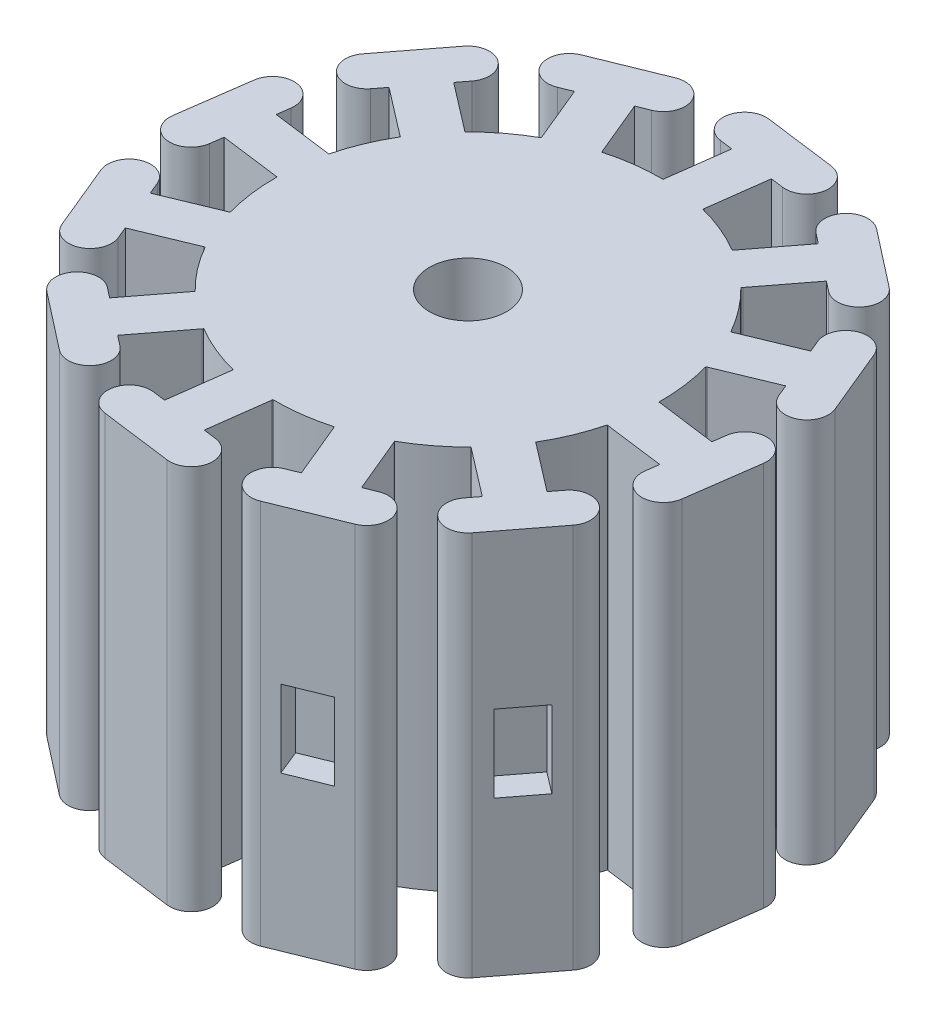
from build123d import *

# Parameters (mm, degrees)
SKETCH_1_R          = 2.54
EXTRUDE_2_DEPTH     = 25.4
SKETCH_2_W          = 2.730070903
SKETCH_2_H          = 5.08
CUT_EXTRUDE_1_DEPTH = 1.778
SKETCH_3_W          = 2.730070902
SKETCH_3_H          = 5.169926763
CUT_EXTRUDE_2_DEPTH = 1.778
SKETCH_4_W          = 2.730070903
SKETCH_4_H          = 5.08
CUT_EXTRUDE_3_DEPTH = 1.778
SKETCH_5_W          = 2.730070903
SKETCH_5_H          = 5.08
CUT_EXTRUDE_4_DEPTH = 1.778
SKETCH_6_W          = 2.730070903
SKETCH_6_H          = 5.08
CUT_EXTRUDE_5_DEPTH = 1.778
SKETCH_7_W          = 2.730070903
SKETCH_7_H          = 5.08
CUT_EXTRUDE_6_DEPTH = 1.778


with BuildPart() as part:
    # 草图1 → 凸台-拉伸2 (new body)
    # profile 1 of 67: a face of its own
    with BuildSketch(Plane(origin=(0, 0, 0), x_dir=(1, 0, 0), z_dir=(0, 1, 0))):
        with BuildLine():
            ThreePointArc((-10.939891148, 6.481069734), (-11.749631471, 4.861238887), (-12.321049317, 3.142805587))
            ThreePointArc((-12.321049317, 3.142805587), (-11.100249711, 1.452157809), (-12.714870875, 0.132445687))
            ThreePointArc((-12.714870875, 0.132445687), (-12.606098783, -1.664859365), (-12.244547677, -3.428780457))
            ThreePointArc((-12.244547677, -3.428780457), (-10.342677906, -4.28407746), (-11.082716607, -6.233688782))
            ThreePointArc((-11.082716607, -6.233688782), (-10.084772106, -7.744859896), (-8.882274136, -9.098938917))
            ThreePointArc((-8.882274136, -9.098938917), (-6.807730408, -8.887019334), (-6.472136767, -10.94517834))
            ThreePointArc((-6.472136767, -10.94517834), (-4.861238887, -11.749631471), (-3.152862858, -12.318479574))
            ThreePointArc((-3.152862858, -12.318479574), (-1.461219041, -11.09906054), (-0.142825459, -12.714758516))
            ThreePointArc((-0.142825459, -12.714758516), (1.664859365, -12.606098783), (3.438775181, -12.241744503))
            ThreePointArc((3.438775181, -12.241744503), (4.292519303, -10.339177143), (6.242734108, -11.077624027))
            ThreePointArc((6.242734108, -11.077624027), (7.744859896, -10.084772106), (9.091684818, -8.889699117))
            ThreePointArc((9.091684818, -8.889699117), (8.881458865, -6.81498308), (10.939891148, -6.481069734))
            ThreePointArc((10.939891148, -6.481069734), (11.749631471, -4.861238887), (12.321049317, -3.142805587))
            ThreePointArc((12.321049317, -3.142805587), (11.100249711, -1.452157809), (12.714870875, -0.132445687))
            ThreePointArc((12.714870875, -0.132445687), (12.715388222, -0.066223742), (12.715560673, 0))
            ThreePointArc((12.715560673, 0), (12.597257085, 1.730490441), (12.244547677, 3.428780457))
            ThreePointArc((12.244547677, 3.428780457), (10.342677906, 4.28407746), (11.082716607, 6.233688782))
            ThreePointArc((11.082716607, 6.233688782), (10.084772106, 7.744859896), (8.882274136, 9.098938917))
            ThreePointArc((8.882274136, 9.098938917), (6.807730408, 8.887019334), (6.472136767, 10.94517834))
            ThreePointArc((6.472136767, 10.94517834), (4.861238887, 11.749631471), (3.152862858, 12.318479574))
            ThreePointArc((3.152862858, 12.318479574), (1.461219041, 11.09906054), (0.142825459, 12.714758516))
            ThreePointArc((0.142825459, 12.714758516), (-1.664859365, 12.606098783), (-3.438775181, 12.241744503))
            ThreePointArc((-3.438775181, 12.241744503), (-4.292519303, 10.339177143), (-6.242734108, 11.077624027))
            ThreePointArc((-6.242734108, 11.077624027), (-7.744859896, 10.084772106), (-9.091684818, 8.889699117))
            ThreePointArc((-9.091684818, 8.889699117), (-8.881458865, 6.81498308), (-10.939891148, 6.481069734))
        make_face()
        with Locations(Location((0, 0, 0), (0, 0, 270))):
            Circle(SKETCH_1_R, mode=Mode.SUBTRACT)
    # profile 2 of 67: a face of its own
    with BuildSketch(Plane(origin=(0, 0, 0), x_dir=(1, 0, 0), z_dir=(0, 1, 0))):
        with BuildLine():
            ThreePointArc((-6.472136767, -10.94517834), (-6.807730408, -8.887019334), (-8.882274136, -9.098938917))
            ThreePointArc((-8.882274136, -9.098938917), (-8.322282237, -9.61379746), (-7.732504998, -10.094248347))
            ThreePointArc((-7.732504998, -10.094248347), (-7.115053224, -10.53857205), (-6.472136767, -10.94517834))
        make_face()
    # profile 3 of 67: a face of its own
    with BuildSketch(Plane(origin=(0, 0, 0), x_dir=(1, 0, 0), z_dir=(0, 1, 0))):
        with BuildLine():
            ThreePointArc((-0.142825459, -12.714758516), (-1.461219041, -11.09906054), (-3.152862858, -12.318479574))
            ThreePointArc((-3.152862858, -12.318479574), (-2.410602044, -12.484970205), (-1.659713717, -12.606777289))
            ThreePointArc((-1.659713717, -12.606777289), (-0.902885295, -12.68346488), (-0.142825459, -12.714758516))
        make_face()
    # profile 4 of 67: a face of its own
    with BuildSketch(Plane(origin=(0, 0, 0), x_dir=(1, 0, 0), z_dir=(0, 1, 0))):
        with BuildLine():
            ThreePointArc((6.242734108, -11.077624027), (4.292519303, -10.339177143), (3.438775181, -12.241744503))
            ThreePointArc((3.438775181, -12.241744503), (4.164651708, -12.014206565), (4.875623001, -11.743669937))
            ThreePointArc((4.875623001, -11.743669937), (5.569144502, -11.431102866), (6.242734108, -11.077624027))
        make_face()
    # profile 5 of 67: a face of its own
    with BuildSketch(Plane(origin=(0, 0, 0), x_dir=(1, 0, 0), z_dir=(0, 1, 0))):
        with BuildLine():
            ThreePointArc((10.939891148, -6.481069734), (8.881458865, -6.81498308), (9.091684818, -8.889699117))
            ThreePointArc((9.091684818, -8.889699117), (9.607000341, -8.330127711), (10.087932534, -7.740742886))
            ThreePointArc((10.087932534, -7.740742886), (10.532760147, -7.123654043), (10.939891148, -6.481069734))
        make_face()
    # profile 6 of 67: a face of its own
    with BuildSketch(Plane(origin=(0, 0, 0), x_dir=(1, 0, 0), z_dir=(0, 1, 0))):
        with BuildLine():
            ThreePointArc((12.714870875, -0.132445687), (11.100249711, -1.452157809), (12.321049317, -3.142805587))
            ThreePointArc((12.321049317, -3.142805587), (12.486933945, -2.400409105), (12.608127999, -1.64942159))
            ThreePointArc((12.608127999, -1.64942159), (12.684197727, -0.892530817), (12.714870875, -0.132445687))
        make_face()
    # profile 7 of 67: a face of its own
    with BuildSketch(Plane(origin=(0, 0, 0), x_dir=(1, 0, 0), z_dir=(0, 1, 0))):
        with BuildLine():
            ThreePointArc((11.74764625, 4.866034403), (11.435645442, 5.559810838), (11.082716607, 6.233688782))
            ThreePointArc((11.082716607, 6.233688782), (10.342677906, 4.28407746), (12.244547677, 3.428780457))
            ThreePointArc((12.244547677, 3.428780457), (12.017602385, 4.154842494), (11.74764625, 4.866034403))
        make_face()
    # profile 8 of 67: a face of its own
    with BuildSketch(Plane(origin=(0, 0, 0), x_dir=(1, 0, 0), z_dir=(0, 1, 0))):
        with BuildLine():
            ThreePointArc((7.732504998, 10.094248347), (7.115053224, 10.53857205), (6.472136767, 10.94517834))
            ThreePointArc((6.472136767, 10.94517834), (6.807730408, 8.887019334), (8.882274136, 9.098938917))
            ThreePointArc((8.882274136, 9.098938917), (8.322282237, 9.61379746), (7.732504998, 10.094248347))
        make_face()
    # profile 9 of 67: a face of its own
    with BuildSketch(Plane(origin=(0, 0, 0), x_dir=(1, 0, 0), z_dir=(0, 1, 0))):
        with BuildLine():
            ThreePointArc((1.659713717, 12.606777289), (0.902885295, 12.68346488), (0.142825459, 12.714758516))
            ThreePointArc((0.142825459, 12.714758516), (1.461219041, 11.09906054), (3.152862858, 12.318479574))
            ThreePointArc((3.152862858, 12.318479574), (2.410602044, 12.484970205), (1.659713717, 12.606777289))
        make_face()
    # profile 10 of 67: a face of its own
    with BuildSketch(Plane(origin=(0, 0, 0), x_dir=(1, 0, 0), z_dir=(0, 1, 0))):
        with BuildLine():
            ThreePointArc((-4.875623001, 11.743669937), (-5.569144502, 11.431102866), (-6.242734108, 11.077624027))
            ThreePointArc((-6.242734108, 11.077624027), (-4.292519303, 10.339177143), (-3.438775181, 12.241744503))
            ThreePointArc((-3.438775181, 12.241744503), (-4.164651708, 12.014206565), (-4.875623001, 11.743669937))
        make_face()
    # profile 11 of 67: a face of its own
    with BuildSketch(Plane(origin=(0, 0, 0), x_dir=(1, 0, 0), z_dir=(0, 1, 0))):
        with BuildLine():
            ThreePointArc((-10.087932534, 7.740742886), (-10.532760147, 7.123654043), (-10.939891148, 6.481069734))
            ThreePointArc((-10.939891148, 6.481069734), (-8.881458865, 6.81498308), (-9.091684818, 8.889699117))
            ThreePointArc((-9.091684818, 8.889699117), (-9.607000341, 8.330127711), (-10.087932534, 7.740742886))
        make_face()
    # profile 12 of 67: a face of its own
    with BuildSketch(Plane(origin=(0, 0, 0), x_dir=(1, 0, 0), z_dir=(0, 1, 0))):
        with BuildLine():
            ThreePointArc((-12.321049317, 3.142805587), (-12.486933945, 2.400409105), (-12.608127999, 1.64942159))
            ThreePointArc((-12.608127999, 1.64942159), (-12.684197727, 0.892530817), (-12.714870875, 0.132445687))
            ThreePointArc((-12.714870875, 0.132445687), (-11.100249711, 1.452157809), (-12.321049317, 3.142805587))
        make_face()
    # profile 13 of 67: a face of its own
    with BuildSketch(Plane(origin=(0, 0, 0), x_dir=(1, 0, 0), z_dir=(0, 1, 0))):
        with BuildLine():
            ThreePointArc((-11.082716607, -6.233688782), (-10.342677906, -4.28407746), (-12.244547677, -3.428780457))
            ThreePointArc((-12.244547677, -3.428780457), (-12.017602385, -4.154842494), (-11.74764625, -4.866034403))
            ThreePointArc((-11.74764625, -4.866034403), (-11.435645442, -5.559810838), (-11.082716607, -6.233688782))
        make_face()
    # profile 14 of 67: a face of its own
    with BuildSketch(Plane(origin=(0, 0, 0), x_dir=(1, 0, 0), z_dir=(0, 1, 0))):
        with BuildLine():
            ThreePointArc((-11.082716607, -6.233688782), (-11.435645442, -5.559810838), (-11.74764625, -4.866034403))
            Line((-11.74764625, -4.866034403), (-15.389919083, -6.374713208))
            Line((-15.389919083, -6.374713208), (-14.80796214, -7.779681552))
            Line((-14.80796214, -7.779681552), (-11.165689307, -6.271002747))
            ThreePointArc((-11.165689307, -6.271002747), (-11.123923858, -6.25296638), (-11.082716607, -6.233688782))
        make_face()
    # profile 15 of 67: a face of its own
    with BuildSketch(Plane(origin=(0, 0, 0), x_dir=(1, 0, 0), z_dir=(0, 1, 0))):
        with BuildLine():
            ThreePointArc((-11.74764625, -4.866034403), (-12.017602385, -4.154842494), (-12.244547677, -3.428780457))
            ThreePointArc((-12.244547677, -3.428780457), (-12.287316923, -3.444287064), (-12.329603193, -3.461066059))
            Line((-12.329603193, -3.461066059), (-15.971876026, -4.969744864))
            Line((-15.971876026, -4.969744864), (-15.389919083, -6.374713208))
            Line((-15.389919083, -6.374713208), (-11.74764625, -4.866034403))
        make_face()
    # profile 16 of 67: a face of its own
    with BuildSketch(Plane(origin=(0, 0, 0), x_dir=(1, 0, 0), z_dir=(0, 1, 0))):
        with BuildLine():
            ThreePointArc((-7.732504998, -10.094248347), (-8.322282237, -9.61379746), (-8.882274136, -9.098938917))
            ThreePointArc((-8.882274136, -9.098938917), (-8.911531656, -9.133776551), (-8.939734011, -9.169473757))
            Line((-8.939734011, -9.169473757), (-11.329656202, -12.289351226))
            Line((-11.329656202, -12.289351226), (-10.129912299, -13.223897107))
            Line((-10.129912299, -13.223897107), (-7.732504998, -10.094248347))
        make_face()
    # profile 17 of 67: a face of its own
    with BuildSketch(Plane(origin=(0, 0, 0), x_dir=(1, 0, 0), z_dir=(0, 1, 0))):
        with BuildLine():
            ThreePointArc((-6.472136767, -10.94517834), (-7.115053224, -10.53857205), (-7.732504998, -10.094248347))
            Line((-7.732504998, -10.094248347), (-10.129912299, -13.223897107))
            Line((-10.129912299, -13.223897107), (-8.930207693, -14.158412377))
            ThreePointArc((-8.930207693, -14.158412377), (-8.926435635, -14.153549649), (-8.922683286, -14.148671697))
            Line((-8.922683286, -14.148671697), (-6.525275986, -11.019022936))
            ThreePointArc((-6.525275986, -11.019022936), (-6.498154037, -10.982498106), (-6.472136767, -10.94517834))
        make_face()
    # profile 18 of 67: a face of its own
    with BuildSketch(Plane(origin=(0, 0, 0), x_dir=(1, 0, 0), z_dir=(0, 1, 0))):
        with BuildLine():
            ThreePointArc((-1.659713717, -12.606777289), (-2.410602044, -12.484970205), (-3.152862858, -12.318479574))
            ThreePointArc((-3.152862858, -12.318479574), (-3.160818366, -12.363272132), (-3.167430465, -12.408282613))
            Line((-3.167430465, -12.408282613), (-3.68201271, -16.316922817))
            Line((-3.68201271, -16.316922817), (-2.174295962, -16.515417492))
            Line((-2.174295962, -16.515417492), (-1.659713717, -12.606777289))
        make_face()
    # profile 19 of 67: a face of its own
    with BuildSketch(Plane(origin=(0, 0, 0), x_dir=(1, 0, 0), z_dir=(0, 1, 0))):
        with BuildLine():
            ThreePointArc((-0.142825459, -12.714758516), (-0.902885295, -12.68346488), (-1.659713717, -12.606777289))
            Line((-1.659713717, -12.606777289), (-2.174295962, -16.515417492))
            Line((-2.174295962, -16.515417492), (-0.666579213, -16.713912168))
            Line((-0.666579213, -16.713912168), (-0.151996968, -12.805271964))
            ThreePointArc((-0.151996968, -12.805271964), (-0.146734195, -12.760083841), (-0.142825459, -12.714758516))
        make_face()
    # profile 20 of 67: a face of its own
    with BuildSketch(Plane(origin=(0, 0, 0), x_dir=(1, 0, 0), z_dir=(0, 1, 0))):
        with BuildLine():
            ThreePointArc((4.875623001, -11.743669937), (4.164651708, -12.014206565), (3.438775181, -12.241744503))
            ThreePointArc((3.438775181, -12.241744503), (3.454316697, -12.284501077), (3.471130207, -12.326773635))
            Line((3.471130207, -12.326773635), (4.978062257, -15.9564457))
            Line((4.978062257, -15.9564457), (6.387274682, -15.384709942))
            Line((6.387274682, -15.384709942), (4.875623001, -11.743669937))
        make_face()
    # profile 21 of 67: a face of its own
    with BuildSketch(Plane(origin=(0, 0, 0), x_dir=(1, 0, 0), z_dir=(0, 1, 0))):
        with BuildLine():
            ThreePointArc((6.242734108, -11.077624027), (5.569144502, -11.431102866), (4.875623001, -11.743669937))
            Line((4.875623001, -11.743669937), (6.387274682, -15.384709942))
            Line((6.387274682, -15.384709942), (7.796440949, -14.812992912))
            ThreePointArc((7.796440949, -14.812992912), (7.794115733, -14.80729485), (7.791767476, -14.801606244))
            Line((7.791767476, -14.801606244), (6.280115795, -11.160566238))
            ThreePointArc((6.280115795, -11.160566238), (6.262045339, -11.118815527), (6.242734108, -11.077624027))
        make_face()
    # profile 22 of 67: a face of its own
    with BuildSketch(Plane(origin=(0, 0, 0), x_dir=(1, 0, 0), z_dir=(0, 1, 0))):
        with BuildLine():
            ThreePointArc((10.087932534, -7.740742886), (9.607000341, -8.330127711), (9.091684818, -8.889699117))
            ThreePointArc((9.091684818, -8.889699117), (9.126498557, -8.918985068), (9.162172728, -8.947216554))
            Line((9.162172728, -8.947216554), (12.289863316, -11.347177953))
            Line((12.289863316, -11.347177953), (13.215623122, -10.140704284))
            Line((13.215623122, -10.140704284), (10.087932534, -7.740742886))
        make_face()
    # profile 23 of 67: a face of its own
    with BuildSketch(Plane(origin=(0, 0, 0), x_dir=(1, 0, 0), z_dir=(0, 1, 0))):
        with BuildLine():
            ThreePointArc((10.939891148, -6.481069734), (10.532760147, -7.123654043), (10.087932534, -7.740742886))
            Line((10.087932534, -7.740742886), (13.215623122, -10.140704284))
            Line((13.215623122, -10.140704284), (14.141382928, -8.934230616))
            Line((14.141382928, -8.934230616), (11.01369234, -6.534269218))
            ThreePointArc((11.01369234, -6.534269218), (10.977189663, -6.507117461), (10.939891148, -6.481069734))
        make_face()
    # profile 24 of 67: a face of its own
    with BuildSketch(Plane(origin=(0, 0, 0), x_dir=(1, 0, 0), z_dir=(0, 1, 0))):
        with BuildLine():
            ThreePointArc((12.608127999, -1.64942159), (12.486933945, -2.400409105), (12.321049317, -3.142805587))
            ThreePointArc((12.321049317, -3.142805587), (12.365848354, -3.150724526), (12.410864218, -3.157299878))
            Line((12.410864218, -3.157299878), (16.307718459, -3.667094474))
            Line((16.307718459, -3.667094474), (16.517186981, -2.160812836))
            Line((16.517186981, -2.160812836), (12.608127999, -1.64942159))
        make_face()
    # profile 25 of 67: a face of its own
    with BuildSketch(Plane(origin=(0, 0, 0), x_dir=(1, 0, 0), z_dir=(0, 1, 0))):
        with BuildLine():
            ThreePointArc((12.805391781, -0.141543302), (12.760199376, -0.136317421), (12.714870875, -0.132445687))
            ThreePointArc((12.714870875, -0.132445687), (12.684197727, -0.892530817), (12.608127999, -1.64942159))
            Line((12.608127999, -1.64942159), (16.517186981, -2.160812836))
            Line((16.517186981, -2.160812836), (16.726648642, -0.654580535))
            ThreePointArc((16.726648642, -0.654580535), (16.720551368, -0.6537452), (16.714450762, -0.652934548))
            Line((16.714450762, -0.652934548), (12.805391781, -0.141543302))
        make_face()
    # profile 26 of 67: a face of its own
    with BuildSketch(Plane(origin=(0, 0, 0), x_dir=(1, 0, 0), z_dir=(0, 1, 0))):
        with BuildLine():
            Line((15.389919083, 6.374713208), (11.74764625, 4.866034403))
            ThreePointArc((11.74764625, 4.866034403), (12.017602385, 4.154842494), (12.244547677, 3.428780457))
            ThreePointArc((12.244547677, 3.428780457), (12.287316923, 3.444287064), (12.329603193, 3.461066059))
            Line((12.329603193, 3.461066059), (15.971876026, 4.969744864))
            Line((15.971876026, 4.969744864), (15.389919083, 6.374713208))
        make_face()
    # profile 27 of 67: a face of its own
    with BuildSketch(Plane(origin=(0, 0, 0), x_dir=(1, 0, 0), z_dir=(0, 1, 0))):
        with BuildLine():
            ThreePointArc((11.165689307, 6.271002747), (11.123923858, 6.25296638), (11.082716607, 6.233688782))
            ThreePointArc((11.082716607, 6.233688782), (11.435645442, 5.559810838), (11.74764625, 4.866034403))
            Line((11.74764625, 4.866034403), (15.389919083, 6.374713208))
            Line((15.389919083, 6.374713208), (14.80796214, 7.779681552))
            Line((14.80796214, 7.779681552), (11.165689307, 6.271002747))
        make_face()
    # profile 28 of 67: a face of its own
    with BuildSketch(Plane(origin=(0, 0, 0), x_dir=(1, 0, 0), z_dir=(0, 1, 0))):
        with BuildLine():
            Line((10.129912299, 13.223897107), (7.732504998, 10.094248347))
            ThreePointArc((7.732504998, 10.094248347), (8.322282237, 9.61379746), (8.882274136, 9.098938917))
            ThreePointArc((8.882274136, 9.098938917), (8.911531656, 9.133776551), (8.939734011, 9.169473757))
            Line((8.939734011, 9.169473757), (11.329656202, 12.289351226))
            Line((11.329656202, 12.289351226), (10.129912299, 13.223897107))
        make_face()
    # profile 29 of 67: a face of its own
    with BuildSketch(Plane(origin=(0, 0, 0), x_dir=(1, 0, 0), z_dir=(0, 1, 0))):
        with BuildLine():
            ThreePointArc((6.525275986, 11.019022936), (6.498154037, 10.982498106), (6.472136767, 10.94517834))
            ThreePointArc((6.472136767, 10.94517834), (7.115053224, 10.53857205), (7.732504998, 10.094248347))
            Line((7.732504998, 10.094248347), (10.129912299, 13.223897107))
            Line((10.129912299, 13.223897107), (8.930207693, 14.158412377))
            ThreePointArc((8.930207693, 14.158412377), (8.926435635, 14.153549649), (8.922683286, 14.148671697))
            Line((8.922683286, 14.148671697), (6.525275986, 11.019022936))
        make_face()
    # profile 30 of 67: a face of its own
    with BuildSketch(Plane(origin=(0, 0, 0), x_dir=(1, 0, 0), z_dir=(0, 1, 0))):
        with BuildLine():
            Line((2.174295962, 16.515417492), (1.659713717, 12.606777289))
            ThreePointArc((1.659713717, 12.606777289), (2.410602044, 12.484970205), (3.152862858, 12.318479574))
            ThreePointArc((3.152862858, 12.318479574), (3.160818366, 12.363272132), (3.167430465, 12.408282613))
            Line((3.167430465, 12.408282613), (3.68201271, 16.316922817))
            Line((3.68201271, 16.316922817), (2.174295962, 16.515417492))
        make_face()
    # profile 31 of 67: a face of its own
    with BuildSketch(Plane(origin=(0, 0, 0), x_dir=(1, 0, 0), z_dir=(0, 1, 0))):
        with BuildLine():
            ThreePointArc((0.151996968, 12.805271964), (0.146734195, 12.760083841), (0.142825459, 12.714758516))
            ThreePointArc((0.142825459, 12.714758516), (0.902885295, 12.68346488), (1.659713717, 12.606777289))
            Line((1.659713717, 12.606777289), (2.174295962, 16.515417492))
            Line((2.174295962, 16.515417492), (0.666579213, 16.713912168))
            Line((0.666579213, 16.713912168), (0.151996968, 12.805271964))
        make_face()
    # profile 32 of 67: a face of its own
    with BuildSketch(Plane(origin=(0, 0, 0), x_dir=(1, 0, 0), z_dir=(0, 1, 0))):
        with BuildLine():
            Line((-6.387274682, 15.384709942), (-4.875623001, 11.743669937))
            ThreePointArc((-4.875623001, 11.743669937), (-4.164651708, 12.014206565), (-3.438775181, 12.241744503))
            ThreePointArc((-3.438775181, 12.241744503), (-3.454316697, 12.284501077), (-3.471130207, 12.326773635))
            Line((-3.471130207, 12.326773635), (-4.978062257, 15.9564457))
            Line((-4.978062257, 15.9564457), (-6.387274682, 15.384709942))
        make_face()
    # profile 33 of 67: a face of its own
    with BuildSketch(Plane(origin=(0, 0, 0), x_dir=(1, 0, 0), z_dir=(0, 1, 0))):
        with BuildLine():
            ThreePointArc((-6.280115795, 11.160566238), (-6.262045339, 11.118815527), (-6.242734108, 11.077624027))
            ThreePointArc((-6.242734108, 11.077624027), (-5.569144502, 11.431102866), (-4.875623001, 11.743669937))
            Line((-4.875623001, 11.743669937), (-6.387274682, 15.384709942))
            Line((-6.387274682, 15.384709942), (-7.796440949, 14.812992912))
            ThreePointArc((-7.796440949, 14.812992912), (-7.794115733, 14.80729485), (-7.791767476, 14.801606244))
            Line((-7.791767476, 14.801606244), (-6.280115795, 11.160566238))
        make_face()
    # profile 34 of 67: a face of its own
    with BuildSketch(Plane(origin=(0, 0, 0), x_dir=(1, 0, 0), z_dir=(0, 1, 0))):
        with BuildLine():
            Line((-13.215623122, 10.140704284), (-10.087932534, 7.740742886))
            ThreePointArc((-10.087932534, 7.740742886), (-9.607000341, 8.330127711), (-9.091684818, 8.889699117))
            ThreePointArc((-9.091684818, 8.889699117), (-9.126498557, 8.918985068), (-9.162172728, 8.947216554))
            Line((-9.162172728, 8.947216554), (-12.289863316, 11.347177953))
            Line((-12.289863316, 11.347177953), (-13.215623122, 10.140704284))
        make_face()
    # profile 35 of 67: a face of its own
    with BuildSketch(Plane(origin=(0, 0, 0), x_dir=(1, 0, 0), z_dir=(0, 1, 0))):
        with BuildLine():
            ThreePointArc((-11.01369234, 6.534269218), (-10.977189663, 6.507117461), (-10.939891148, 6.481069734))
            ThreePointArc((-10.939891148, 6.481069734), (-10.532760147, 7.123654043), (-10.087932534, 7.740742886))
            Line((-10.087932534, 7.740742886), (-13.215623122, 10.140704284))
            Line((-13.215623122, 10.140704284), (-14.141382928, 8.934230616))
            Line((-14.141382928, 8.934230616), (-11.01369234, 6.534269218))
        make_face()
    # profile 36 of 67: a face of its own
    with BuildSketch(Plane(origin=(0, 0, 0), x_dir=(1, 0, 0), z_dir=(0, 1, 0))):
        with BuildLine():
            Line((-16.307718459, 3.667094474), (-16.517186981, 2.160812836))
            Line((-16.517186981, 2.160812836), (-12.608127999, 1.64942159))
            ThreePointArc((-12.608127999, 1.64942159), (-12.486933945, 2.400409105), (-12.321049317, 3.142805587))
            ThreePointArc((-12.321049317, 3.142805587), (-12.365848354, 3.150724526), (-12.410864218, 3.157299878))
            Line((-12.410864218, 3.157299878), (-16.307718459, 3.667094474))
        make_face()
    # profile 37 of 67: a face of its own
    with BuildSketch(Plane(origin=(0, 0, 0), x_dir=(1, 0, 0), z_dir=(0, 1, 0))):
        with BuildLine():
            Line((-12.608127999, 1.64942159), (-16.517186981, 2.160812836))
            Line((-16.517186981, 2.160812836), (-16.726648642, 0.654580535))
            ThreePointArc((-16.726648642, 0.654580535), (-16.720551368, 0.6537452), (-16.714450762, 0.652934548))
            Line((-16.714450762, 0.652934548), (-12.805391781, 0.141543302))
            ThreePointArc((-12.805391781, 0.141543302), (-12.760199376, 0.136317421), (-12.714870875, 0.132445687))
            ThreePointArc((-12.714870875, 0.132445687), (-12.684197727, 0.892530817), (-12.608127999, 1.64942159))
        make_face()
    # profile 38 of 67: a face of its own
    with BuildSketch(Plane(origin=(0, 0, 0), x_dir=(1, 0, 0), z_dir=(0, 1, 0))):
        with BuildLine():
            Line((-16.726648642, 0.654580535), (-16.517186981, 2.160812836))
            Line((-16.517186981, 2.160812836), (-16.307718459, 3.667094474))
            Line((-16.307718459, 3.667094474), (-16.3199232, 3.668691124))
            ThreePointArc((-16.3199232, 3.668691124), (-18.024254616, 2.364177222), (-16.726648642, 0.654580535))
        make_face()
    # profile 39 of 67: a face of its own
    with BuildSketch(Plane(origin=(0, 0, 0), x_dir=(1, 0, 0), z_dir=(0, 1, 0))):
        with BuildLine():
            Line((-16.3199232, 3.668691124), (-16.307718459, 3.667094474))
            Line((-16.307718459, 3.667094474), (-16.189228239, 4.519153965))
            ThreePointArc((-16.189228239, 4.519153965), (-16.293704594, 5.281478626), (-16.780490081, 5.87737634))
            ThreePointArc((-16.780490081, 5.87737634), (-18.162362484, 6.016640694), (-19.002000908, 4.910307465))
            Line((-19.002000908, 4.910307465), (-19.657918393, 0.193625206))
            ThreePointArc((-19.657918393, 0.193625206), (-19.129613343, -1.117812667), (-17.730716742, -1.322907332))
            ThreePointArc((-17.730716742, -1.322907332), (-17.135670935, -0.880032828), (-16.845145723, -0.197528294))
            Line((-16.845145723, -0.197528294), (-16.726648642, 0.654580535))
            ThreePointArc((-16.726648642, 0.654580535), (-18.024254616, 2.364177222), (-16.3199232, 3.668691124))
        make_face()
    # profile 40 of 67: a face of its own
    with BuildSketch(Plane(origin=(0, 0, 0), x_dir=(1, 0, 0), z_dir=(0, 1, 0))):
        with BuildLine():
            ThreePointArc((-16.301101902, -4.174923288), (-16.766562062, -3.584281539), (-17.468387747, -3.314186102))
            ThreePointArc((-17.468387747, -3.314186102), (-18.749241341, -3.880572147), (-18.921093117, -5.270480794))
            Line((-18.921093117, -5.270480794), (-17.106025961, -9.652440541))
            ThreePointArc((-17.106025961, -9.652440541), (-16.001694574, -10.513736814), (-14.695498899, -10.008531965))
            ThreePointArc((-14.695498899, -10.008531965), (-14.390219513, -9.32127995), (-14.478736264, -8.574503128))
            Line((-14.478736264, -8.574503128), (-14.80796214, -7.779681552))
            ThreePointArc((-14.80796214, -7.779681552), (-16.794887427, -6.956670151), (-15.971876026, -4.969744864))
            Line((-15.971876026, -4.969744864), (-16.301101902, -4.174923288))
        make_face()
    # profile 41 of 67: a face of its own
    with BuildSketch(Plane(origin=(0, 0, 0), x_dir=(1, 0, 0), z_dir=(0, 1, 0))):
        with BuildLine():
            Line((-14.80796214, -7.779681552), (-15.389919083, -6.374713208))
            Line((-15.389919083, -6.374713208), (-15.971876026, -4.969744864))
            ThreePointArc((-15.971876026, -4.969744864), (-16.794887427, -6.956670151), (-14.80796214, -7.779681552))
        make_face()
    # profile 42 of 67: a face of its own
    with BuildSketch(Plane(origin=(0, 0, 0), x_dir=(1, 0, 0), z_dir=(0, 1, 0))):
        with BuildLine():
            Line((-11.337141312, -12.299122517), (-11.329656202, -12.289351226))
            Line((-11.329656202, -12.289351226), (-12.008316257, -11.76070594))
            ThreePointArc((-12.008316257, -11.76070594), (-12.720746956, -11.470022788), (-13.480202259, -11.593642528))
            ThreePointArc((-13.480202259, -11.593642528), (-14.291744929, -12.720746956), (-13.753451459, -14.001061777))
            Line((-13.753451459, -14.001061777), (-9.996643544, -16.927444111))
            ThreePointArc((-9.996643544, -16.927444111), (-8.596752505, -17.125637453), (-7.719687015, -16.016704792))
            ThreePointArc((-7.719687015, -16.016704792), (-7.805704682, -15.279942755), (-8.251508341, -14.687088274))
            Line((-8.251508341, -14.687088274), (-8.930207693, -14.158412377))
            ThreePointArc((-8.930207693, -14.158412377), (-11.059564842, -14.427373771), (-11.337141312, -12.299122517))
        make_face()
    # profile 43 of 67: a face of its own
    with BuildSketch(Plane(origin=(0, 0, 0), x_dir=(1, 0, 0), z_dir=(0, 1, 0))):
        with BuildLine():
            Line((-8.930207693, -14.158412377), (-10.129912299, -13.223897107))
            Line((-10.129912299, -13.223897107), (-11.329656202, -12.289351226))
            Line((-11.329656202, -12.289351226), (-11.337141312, -12.299122517))
            ThreePointArc((-11.337141312, -12.299122517), (-11.059564842, -14.427373771), (-8.930207693, -14.158412377))
        make_face()
    # profile 44 of 67: a face of its own
    with BuildSketch(Plane(origin=(0, 0, 0), x_dir=(1, 0, 0), z_dir=(0, 1, 0))):
        with BuildLine():
            ThreePointArc((-0.666579213, -16.713912168), (-2.372790637, -18.023134241), (-3.68201271, -16.316922817))
            Line((-3.68201271, -16.316922817), (-4.534961324, -16.204630001))
            ThreePointArc((-4.534961324, -16.204630001), (-5.279202164, -16.312409449), (-5.864024516, -16.785160603))
            ThreePointArc((-5.864024516, -16.785160603), (-6.01394661, -18.177605376), (-4.896176301, -19.021387704))
            Line((-4.896176301, -19.021387704), (-0.193754263, -19.64047331))
            ThreePointArc((-0.193754263, -19.64047331), (1.104315883, -19.114742412), (1.319893487, -17.730941351))
            ThreePointArc((1.319893487, -17.730941351), (0.877355476, -17.122935639), (0.186369401, -16.826204983))
            Line((0.186369401, -16.826204983), (-0.666579213, -16.713912168))
        make_face()
    # profile 45 of 67: a face of its own
    with BuildSketch(Plane(origin=(0, 0, 0), x_dir=(1, 0, 0), z_dir=(0, 1, 0))):
        with BuildLine():
            Line((-0.666579213, -16.713912168), (-2.174295962, -16.515417492))
            Line((-2.174295962, -16.515417492), (-3.68201271, -16.316922817))
            ThreePointArc((-3.68201271, -16.316922817), (-2.372790637, -18.023134241), (-0.666579213, -16.713912168))
        make_face()
    # profile 46 of 67: a face of its own
    with BuildSketch(Plane(origin=(0, 0, 0), x_dir=(1, 0, 0), z_dir=(0, 1, 0))):
        with BuildLine():
            Line((4.982781888, -15.967813641), (4.978062257, -15.9564457))
            Line((4.978062257, -15.9564457), (4.180911982, -16.279859905))
            ThreePointArc((4.180911982, -16.279859905), (3.572957638, -16.751501413), (3.300287822, -17.471018868))
            ThreePointArc((3.300287822, -17.471018868), (3.870617555, -18.737387651), (5.248549449, -18.911369242))
            Line((5.248549449, -18.911369242), (9.661274849, -17.121069317))
            ThreePointArc((9.661274849, -17.121069317), (10.532860837, -16.007824786), (10.011029728, -14.69379746))
            ThreePointArc((10.011029728, -14.69379746), (9.329966253, -14.399909927), (8.593637382, -14.48955998))
            Line((8.593637382, -14.48955998), (7.796440949, -14.812992912))
            ThreePointArc((7.796440949, -14.812992912), (6.964689775, -16.791550993), (4.982781888, -15.967813641))
        make_face()
    # profile 47 of 67: a face of its own
    with BuildSketch(Plane(origin=(0, 0, 0), x_dir=(1, 0, 0), z_dir=(0, 1, 0))):
        with BuildLine():
            Line((7.796440949, -14.812992912), (6.387274682, -15.384709942))
            Line((6.387274682, -15.384709942), (4.978062257, -15.9564457))
            Line((4.978062257, -15.9564457), (4.982781888, -15.967813641))
            ThreePointArc((4.982781888, -15.967813641), (6.964689775, -16.791550993), (7.796440949, -14.812992912))
        make_face()
    # profile 48 of 67: a face of its own
    with BuildSketch(Plane(origin=(0, 0, 0), x_dir=(1, 0, 0), z_dir=(0, 1, 0))):
        with BuildLine():
            Line((14.141382928, -8.934230616), (13.215623122, -10.140704284))
            Line((13.215623122, -10.140704284), (12.289863316, -11.347177953))
            ThreePointArc((12.289863316, -11.347177953), (14.42209679, -11.06646409), (14.141382928, -8.934230616))
        make_face()
    # profile 49 of 67: a face of its own
    with BuildSketch(Plane(origin=(0, 0, 0), x_dir=(1, 0, 0), z_dir=(0, 1, 0))):
        with BuildLine():
            ThreePointArc((14.141382928, -8.934230616), (14.42209679, -11.06646409), (12.289863316, -11.347177953))
            Line((12.289863316, -11.347177953), (11.766140578, -12.029706713))
            ThreePointArc((11.766140578, -12.029706713), (11.487359898, -12.72812791), (11.604363231, -13.470974501))
            ThreePointArc((11.604363231, -13.470974501), (12.735294731, -14.297033229), (14.024916817, -13.75090691))
            Line((14.024916817, -13.75090691), (16.912271697, -9.988032769))
            ThreePointArc((16.912271697, -9.988032769), (17.106010457, -8.601005598), (16.015392386, -7.722409385))
            ThreePointArc((16.015392386, -7.722409385), (15.267574989, -7.801655689), (14.665105666, -8.251701856))
            Line((14.665105666, -8.251701856), (14.141382928, -8.934230616))
        make_face()
    # profile 50 of 67: a face of its own
    with BuildSketch(Plane(origin=(0, 0, 0), x_dir=(1, 0, 0), z_dir=(0, 1, 0))):
        with BuildLine():
            Line((16.726648642, -0.654580535), (16.517186981, -2.160812836))
            Line((16.517186981, -2.160812836), (16.307718459, -3.667094474))
            Line((16.307718459, -3.667094474), (16.3199232, -3.668691124))
            ThreePointArc((16.3199232, -3.668691124), (18.024254616, -2.364177222), (16.726648642, -0.654580535))
        make_face()
    # profile 51 of 67: a face of its own
    with BuildSketch(Plane(origin=(0, 0, 0), x_dir=(1, 0, 0), z_dir=(0, 1, 0))):
        with BuildLine():
            Line((16.3199232, -3.668691124), (16.307718459, -3.667094474))
            Line((16.307718459, -3.667094474), (16.189228239, -4.519153965))
            ThreePointArc((16.189228239, -4.519153965), (16.293704594, -5.281478626), (16.780490081, -5.87737634))
            ThreePointArc((16.780490081, -5.87737634), (18.162362484, -6.016640694), (19.002000908, -4.910307465))
            Line((19.002000908, -4.910307465), (19.657918393, -0.193625206))
            ThreePointArc((19.657918393, -0.193625206), (19.129613343, 1.117812667), (17.730716742, 1.322907332))
            ThreePointArc((17.730716742, 1.322907332), (17.135670935, 0.880032828), (16.845145723, 0.197528294))
            Line((16.845145723, 0.197528294), (16.726648642, -0.654580535))
            ThreePointArc((16.726648642, -0.654580535), (18.024254616, -2.364177222), (16.3199232, -3.668691124))
        make_face()
    # profile 52 of 67: a face of its own
    with BuildSketch(Plane(origin=(0, 0, 0), x_dir=(1, 0, 0), z_dir=(0, 1, 0))):
        with BuildLine():
            Line((14.80796214, 7.779681552), (15.389919083, 6.374713208))
            Line((15.389919083, 6.374713208), (15.971876026, 4.969744864))
            ThreePointArc((15.971876026, 4.969744864), (16.794887427, 6.956670151), (14.80796214, 7.779681552))
        make_face()
    # profile 53 of 67: a face of its own
    with BuildSketch(Plane(origin=(0, 0, 0), x_dir=(1, 0, 0), z_dir=(0, 1, 0))):
        with BuildLine():
            Line((14.478736264, 8.574503128), (14.80796214, 7.779681552))
            ThreePointArc((14.80796214, 7.779681552), (16.794887427, 6.956670151), (15.971876026, 4.969744864))
            Line((15.971876026, 4.969744864), (16.301101902, 4.174923288))
            ThreePointArc((16.301101902, 4.174923288), (16.766562062, 3.584281539), (17.468387747, 3.314186102))
            ThreePointArc((17.468387747, 3.314186102), (18.749241341, 3.880572147), (18.921093117, 5.270480794))
            Line((18.921093117, 5.270480794), (17.106025961, 9.652440541))
            ThreePointArc((17.106025961, 9.652440541), (16.001694574, 10.513736814), (14.695498899, 10.008531965))
            ThreePointArc((14.695498899, 10.008531965), (14.390219513, 9.32127995), (14.478736264, 8.574503128))
        make_face()
    # profile 54 of 67: a face of its own
    with BuildSketch(Plane(origin=(0, 0, 0), x_dir=(1, 0, 0), z_dir=(0, 1, 0))):
        with BuildLine():
            Line((8.930207693, 14.158412377), (10.129912299, 13.223897107))
            Line((10.129912299, 13.223897107), (11.329656202, 12.289351226))
            Line((11.329656202, 12.289351226), (11.337141312, 12.299122517))
            ThreePointArc((11.337141312, 12.299122517), (11.601886159, 12.841924743), (11.634484495, 13.444968224))
            ThreePointArc((11.634484495, 13.444968224), (10.812259279, 14.114653708), (9.951572659, 14.734130501))
            ThreePointArc((9.951572659, 14.734130501), (9.383176519, 14.548659578), (8.930207693, 14.158412377))
        make_face()
    # profile 55 of 67: a face of its own
    with BuildSketch(Plane(origin=(0, 0, 0), x_dir=(1, 0, 0), z_dir=(0, 1, 0))):
        with BuildLine():
            Line((11.337141312, 12.299122517), (11.329656202, 12.289351226))
            Line((11.329656202, 12.289351226), (12.008316257, 11.76070594))
            ThreePointArc((12.008316257, 11.76070594), (12.720746956, 11.470022788), (13.480202259, 11.593642528))
            ThreePointArc((13.480202259, 11.593642528), (12.59141471, 12.553273502), (11.634484495, 13.444968224))
            ThreePointArc((11.634484495, 13.444968224), (11.601886159, 12.841924743), (11.337141312, 12.299122517))
        make_face()
    # profile 56 of 67: a face of its own
    with BuildSketch(Plane(origin=(0, 0, 0), x_dir=(1, 0, 0), z_dir=(0, 1, 0))):
        with BuildLine():
            ThreePointArc((9.996643544, 16.927444111), (8.596752505, 17.125637453), (7.719687015, 16.016704792))
            ThreePointArc((7.719687015, 16.016704792), (8.858871475, 15.415861837), (9.951572659, 14.734130501))
            ThreePointArc((9.951572659, 14.734130501), (11.054686889, 14.431126119), (11.634484495, 13.444968224))
            ThreePointArc((11.634484495, 13.444968224), (12.59141471, 12.553273502), (13.480202259, 11.593642528))
            ThreePointArc((13.480202259, 11.593642528), (14.291744929, 12.720746956), (13.753451459, 14.001061777))
            Line((13.753451459, 14.001061777), (9.996643544, 16.927444111))
        make_face()
    # profile 57 of 67: a face of its own
    with BuildSketch(Plane(origin=(0, 0, 0), x_dir=(1, 0, 0), z_dir=(0, 1, 0))):
        with BuildLine():
            ThreePointArc((11.634484495, 13.444968224), (11.054686889, 14.431126119), (9.951572659, 14.734130501))
            ThreePointArc((9.951572659, 14.734130501), (10.812259279, 14.114653708), (11.634484495, 13.444968224))
        make_face()
    # profile 58 of 67: a face of its own
    with BuildSketch(Plane(origin=(0, 0, 0), x_dir=(1, 0, 0), z_dir=(0, 1, 0))):
        with BuildLine():
            Line((8.251508341, 14.687088274), (8.930207693, 14.158412377))
            ThreePointArc((8.930207693, 14.158412377), (9.383176519, 14.548659578), (9.951572659, 14.734130501))
            ThreePointArc((9.951572659, 14.734130501), (8.858871475, 15.415861837), (7.719687015, 16.016704792))
            ThreePointArc((7.719687015, 16.016704792), (7.805704682, 15.279942755), (8.251508341, 14.687088274))
        make_face()
    # profile 59 of 67: a face of its own
    with BuildSketch(Plane(origin=(0, 0, 0), x_dir=(1, 0, 0), z_dir=(0, 1, 0))):
        with BuildLine():
            ThreePointArc((-1.328613864, 17.730290048), (-0.031527037, 17.779972049), (1.265727823, 17.734890275))
            ThreePointArc((1.265727823, 17.734890275), (2.372790637, 18.023134241), (3.367528173, 17.45818301))
            ThreePointArc((3.367528173, 17.45818301), (4.632248167, 17.165974395), (5.872279184, 16.782274494))
            ThreePointArc((5.872279184, 16.782274494), (6.023814154, 18.175446448), (4.905634824, 19.020174763))
            Line((4.905634824, 19.020174763), (0.184304099, 19.641749745))
            ThreePointArc((0.184304099, 19.641749745), (-1.11440597, 19.115210955), (-1.328613864, 17.730290048))
        make_face()
    # profile 60 of 67: a face of its own
    with BuildSketch(Plane(origin=(0, 0, 0), x_dir=(1, 0, 0), z_dir=(0, 1, 0))):
        with BuildLine():
            Line((0.666579213, 16.713912168), (2.174295962, 16.515417492))
            Line((2.174295962, 16.515417492), (3.68201271, 16.316922817))
            ThreePointArc((3.68201271, 16.316922817), (3.640379189, 16.919409946), (3.367528173, 17.45818301))
            ThreePointArc((3.367528173, 17.45818301), (2.320755698, 17.627889635), (1.265727823, 17.734890275))
            ThreePointArc((1.265727823, 17.734890275), (0.86272925, 17.285094498), (0.666579213, 16.713912168))
        make_face()
    # profile 61 of 67: a face of its own
    with BuildSketch(Plane(origin=(0, 0, 0), x_dir=(1, 0, 0), z_dir=(0, 1, 0))):
        with BuildLine():
            Line((-14.141382928, 8.934230616), (-13.215623122, 10.140704284))
            Line((-13.215623122, 10.140704284), (-12.289863316, 11.347177953))
            ThreePointArc((-12.289863316, 11.347177953), (-14.42209679, 11.06646409), (-14.141382928, 8.934230616))
        make_face()
    # profile 62 of 67: a face of its own
    with BuildSketch(Plane(origin=(0, 0, 0), x_dir=(1, 0, 0), z_dir=(0, 1, 0))):
        with BuildLine():
            ThreePointArc((-16.912271697, 9.988032769), (-17.106010457, 8.601005598), (-16.015392386, 7.722409385))
            ThreePointArc((-16.015392386, 7.722409385), (-15.267574989, 7.801655689), (-14.665105666, 8.251701856))
            Line((-14.665105666, 8.251701856), (-14.141382928, 8.934230616))
            ThreePointArc((-14.141382928, 8.934230616), (-14.42209679, 11.06646409), (-12.289863316, 11.347177953))
            Line((-12.289863316, 11.347177953), (-11.766140578, 12.029706713))
            ThreePointArc((-11.766140578, 12.029706713), (-11.487359898, 12.72812791), (-11.604363231, 13.470974501))
            ThreePointArc((-11.604363231, 13.470974501), (-12.735294731, 14.297033229), (-14.024916817, 13.75090691))
            Line((-14.024916817, 13.75090691), (-16.912271697, 9.988032769))
        make_face()
    # profile 63 of 67: a face of its own
    with BuildSketch(Plane(origin=(0, 0, 0), x_dir=(1, 0, 0), z_dir=(0, 1, 0))):
        with BuildLine():
            Line((-7.796440949, 14.812992912), (-6.387274682, 15.384709942))
            Line((-6.387274682, 15.384709942), (-4.978062257, 15.9564457))
            Line((-4.978062257, 15.9564457), (-4.982781888, 15.967813641))
            ThreePointArc((-4.982781888, 15.967813641), (-6.964689775, 16.791550993), (-7.796440949, 14.812992912))
        make_face()
    # profile 64 of 67: a face of its own
    with BuildSketch(Plane(origin=(0, 0, 0), x_dir=(1, 0, 0), z_dir=(0, 1, 0))):
        with BuildLine():
            Line((-4.982781888, 15.967813641), (-4.978062257, 15.9564457))
            Line((-4.978062257, 15.9564457), (-4.180911982, 16.279859905))
            ThreePointArc((-4.180911982, 16.279859905), (-3.572957638, 16.751501413), (-3.300287822, 17.471018868))
            ThreePointArc((-3.300287822, 17.471018868), (-3.870617555, 18.737387651), (-5.248549449, 18.911369242))
            Line((-5.248549449, 18.911369242), (-9.661274849, 17.121069317))
            ThreePointArc((-9.661274849, 17.121069317), (-10.532860837, 16.007824786), (-10.011029728, 14.69379746))
            ThreePointArc((-10.011029728, 14.69379746), (-9.329966253, 14.399909927), (-8.593637382, 14.48955998))
            Line((-8.593637382, 14.48955998), (-7.796440949, 14.812992912))
            ThreePointArc((-7.796440949, 14.812992912), (-6.964689775, 16.791550993), (-4.982781888, 15.967813641))
        make_face()
    # profile 65 of 67: a face of its own
    with BuildSketch(Plane(origin=(0, 0, 0), x_dir=(1, 0, 0), z_dir=(0, 1, 0))):
        with BuildLine():
            ThreePointArc((3.367528173, 17.45818301), (2.372790637, 18.023134241), (1.265727823, 17.734890275))
            ThreePointArc((1.265727823, 17.734890275), (2.320755698, 17.627889635), (3.367528173, 17.45818301))
        make_face()
    # profile 66 of 67: a face of its own
    with BuildSketch(Plane(origin=(0, 0, 0), x_dir=(1, 0, 0), z_dir=(0, 1, 0))):
        with BuildLine():
            Line((-0.186369401, 16.826204983), (0.666579213, 16.713912168))
            ThreePointArc((0.666579213, 16.713912168), (0.86272925, 17.285094498), (1.265727823, 17.734890275))
            ThreePointArc((1.265727823, 17.734890275), (-0.031527037, 17.779972049), (-1.328613864, 17.730290048))
            ThreePointArc((-1.328613864, 17.730290048), (-0.882266242, 17.120604046), (-0.186369401, 16.826204983))
        make_face()
    # profile 67 of 67: a face of its own
    with BuildSketch(Plane(origin=(0, 0, 0), x_dir=(1, 0, 0), z_dir=(0, 1, 0))):
        with BuildLine():
            ThreePointArc((3.367528173, 17.45818301), (3.640379189, 16.919409946), (3.68201271, 16.316922817))
            Line((3.68201271, 16.316922817), (4.534961324, 16.204630001))
            ThreePointArc((4.534961324, 16.204630001), (5.28334214, 16.308886303), (5.872279184, 16.782274494))
            ThreePointArc((5.872279184, 16.782274494), (4.632248167, 17.165974395), (3.367528173, 17.45818301))
        make_face()
    extrude(amount=EXTRUDE_2_DEPTH)

    # 草图2 → 切除-拉伸1 (cut)
    with BuildSketch(Plane(origin=(11.981410895, 0, -15.381400703), x_dir=(-0.7889021378611626, 0, -0.6145188498964758), z_dir=(0.6145188498964758, 0, -0.7889021378611626))):
        with Locations((0.134824573, 12.7)):
            Rectangle(SKETCH_2_W, SKETCH_2_H)
    extrude(amount=-CUT_EXTRUDE_1_DEPTH, mode=Mode.SUBTRACT)

    # 草图3 → 切除-拉伸2 (cut)
    with BuildSketch(Plane(origin=(2.544969462, 0, -19.330962254), x_dir=(-0.9914448613738102, 0, -0.13052619222005404), z_dir=(0.13052619222005404, 0, -0.9914448613738102))):
        with Locations((0, 12.655036619)):
            Rectangle(SKETCH_3_W, SKETCH_3_H)
    extrude(amount=-CUT_EXTRUDE_2_DEPTH, mode=Mode.SUBTRACT)

    # 草图4 → 切除-拉伸3 (cut)
    with BuildSketch(Plane(origin=(15.468594257, 0, 11.86946984), x_dir=(0.6087614290087214, 0, -0.7933533402912345), z_dir=(0.7933533402912345, 0, 0.6087614290087214))):
        with Locations((0.009535926, 12.7)):
            Rectangle(SKETCH_4_W, SKETCH_4_H)
    extrude(amount=-CUT_EXTRUDE_3_DEPTH, mode=Mode.SUBTRACT)

    # 草图5 → 切除-拉伸4 (cut)
    with BuildSketch(Plane(origin=(7.329978307, 0, 18.066906559), x_dir=(0.9266400040453279, 0, -0.3759498675393766), z_dir=(0.3759498675393766, 0, 0.9266400040453279))):
        with Locations((0.134824573, 12.7)):
            Rectangle(SKETCH_5_W, SKETCH_5_H)
    extrude(amount=-CUT_EXTRUDE_4_DEPTH, mode=Mode.SUBTRACT)

    # 草图6 → 切除-拉伸5 (cut)
    with BuildSketch(Plane(origin=(-19.311389202, 0, -2.685505857), x_dir=(-0.13773786618415956, 0, 0.9904687174358585), z_dir=(-0.9904687174358585, 0, -0.13773786618415956))):
        with Locations((0.134824573, 12.7)):
            Rectangle(SKETCH_6_W, SKETCH_6_H)
    extrude(amount=-CUT_EXTRUDE_5_DEPTH, mode=Mode.SUBTRACT)

    # 草图7 → 切除-拉伸6 (cut)
    with BuildSketch(Plane(origin=(-15.468594257, 0, -11.86946984), x_dir=(-0.6087614290087014, 0, 0.7933533402912499), z_dir=(-0.7933533402912499, 0, -0.6087614290087014))):
        with Locations((0.009535926, 12.7)):
            Rectangle(SKETCH_7_W, SKETCH_7_H)
    extrude(amount=-CUT_EXTRUDE_6_DEPTH, mode=Mode.SUBTRACT)


solid = part.part
